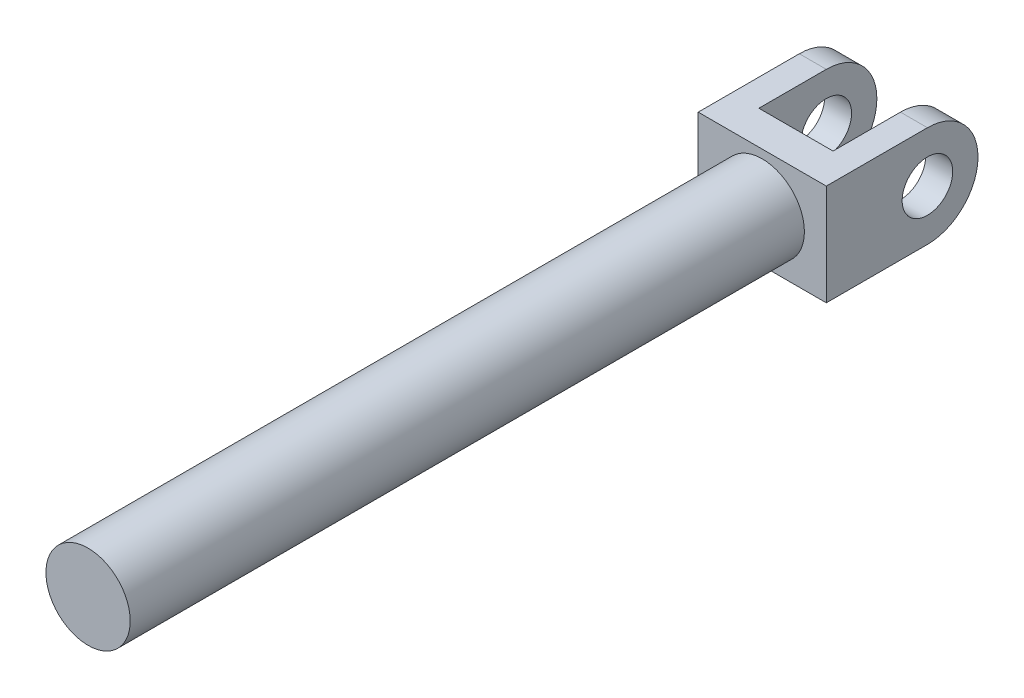
from build123d import *

# Parameters (mm, degrees)
SKETCH_1_R          = 7.5
EXTRUDE_1_DEPTH     = 19
SKETCH_2_W          = 22
SKETCH_2_H          = 35
CUT_EXTRUDE_1_DEPTH = 47.486557197
SKETCH_4_R          = 12.5
EXTRUDE_2_DEPTH     = 200


with BuildPart() as part:
    # 草图1 → 凸台-拉伸1 (new, symmetric)
    with BuildSketch(Plane(origin=(0, 0, 0), x_dir=(0, 0, -1), z_dir=(1, 0, 0))):
        with BuildLine():
            Line((0, -15), (-30, -15))
            Line((-30, -15), (-30, 15))
            Line((-30, 15), (0, 15))
            ThreePointArc((0, 15), (15, 0), (0, -15))
        make_face()
        Circle(SKETCH_1_R, mode=Mode.SUBTRACT)
    extrude(amount=EXTRUDE_1_DEPTH, both=True)

    # 草图2 → 切除-拉伸1 (cut, through all)
    with BuildSketch(Plane(origin=(0, 15, 0), x_dir=(1, 0, 0), z_dir=(0, 1, 0))):
        with Locations((0, -2.5)):
            Rectangle(SKETCH_2_W, SKETCH_2_H)
    extrude(amount=-CUT_EXTRUDE_1_DEPTH, mode=Mode.SUBTRACT)

    # 草图4 → 凸台-拉伸2 (add)
    with BuildSketch(Plane.XY.offset(30)):
        Circle(SKETCH_4_R)
    extrude(amount=EXTRUDE_2_DEPTH)


solid = part.part
